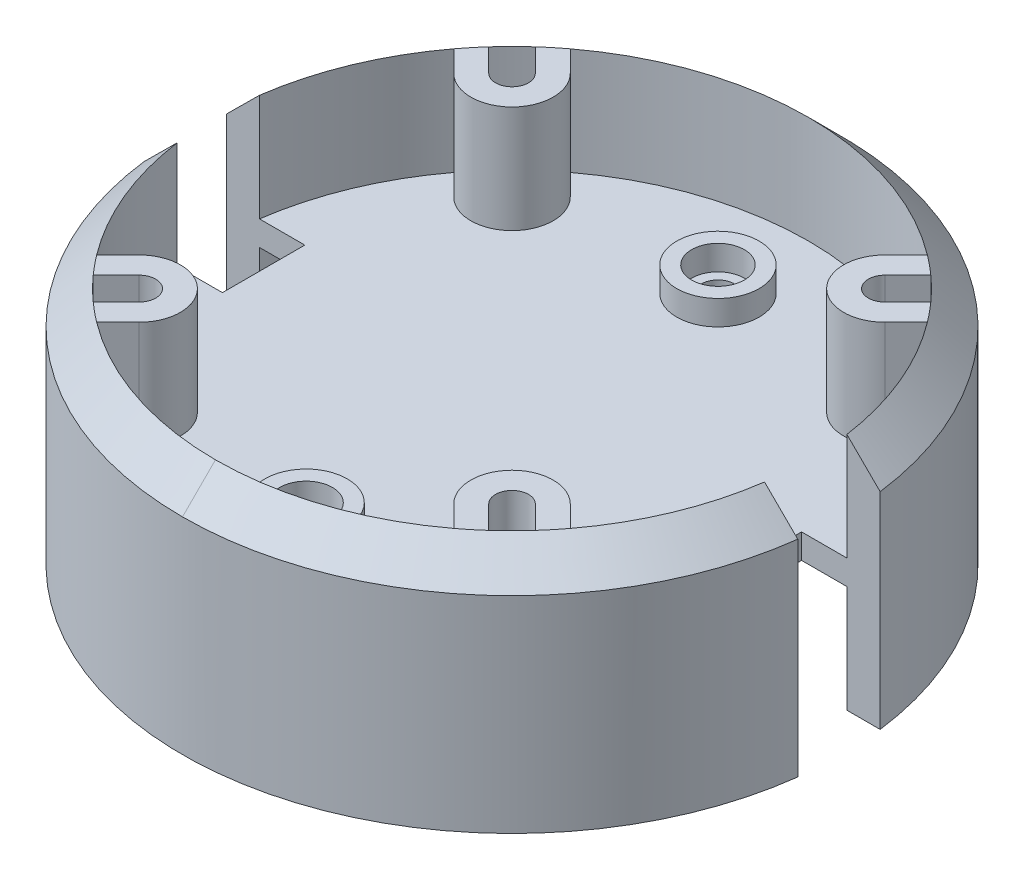
from build123d import *
from build123d.topology import SkipClean

# Parameters (mm, degrees)
SKETCH_1_R               = 18
EXTRUDE_1_DEPTH          = 1.5
EXTRUDE_2_DEPTH          = 6
EXTRUDE_2_DEPTH_BACK     = 6.5
SKETCH_2_R               = 20
SKETCH_2_R_2             = 18
CUT_EXTRUDE_START        = 1.5
SKETCH_6_R               = 1
CUT_EXTRUDE_4_DEPTH      = 8
CUT_EXTRUDE_5_DEPTH      = 30.393876913
CUT_EXTRUDE_5_DEPTH_BACK = 30.393876913
CUT_EXTRUDE_6_DEPTH      = 1.5
EXTRUDE_START            = 8
EXTRUDE_3_DEPTH          = 6.5
EXTRUDE_START_2          = 1.5
SKETCH_10_R              = 2.5
SKETCH_10_R_2            = 1.6
EXTRUDE_4_DEPTH          = 1.5


with BuildPart() as part:
    # 草图1 → 凸台-拉伸1 (new body)
    with BuildSketch(Plane(origin=(0, 0, 0), x_dir=(1, 0, 0), z_dir=(0, 1, 0))):
        with Locations(Location((0, 0, 0), (0, 0, 270))):
            Circle(SKETCH_1_R)
    extrude(amount=EXTRUDE_1_DEPTH)

    # 草图2 → 凸台-拉伸2 (add, two sides: drawn at the far end of the back side and taken through both)
    with BuildSketch(Plane(origin=(0, 0, 0), x_dir=(1, 0, 0), z_dir=(0, 1, 0)).offset(-EXTRUDE_2_DEPTH_BACK)):
        with Locations(Location((0, 0, 0), (0, 0, 270))):
            Circle(SKETCH_2_R)
        with Locations(Location((0, 0, 0), (0, 0, 270))):
            Circle(SKETCH_2_R_2, mode=Mode.SUBTRACT)
    extrude(amount=EXTRUDE_2_DEPTH + EXTRUDE_2_DEPTH_BACK)

    # 扫描2: sweep along a curve in space
    with SkipClean():  # the faces are left unmerged after this step: merging them gives an invalid solid
        with BuildLine() as sweep_2_path:
            ThreePointArc((0, 6, 18), (12.727922061, 6, 12.727922061), (18, 6, 0))
            ThreePointArc((18, 6, 0), (12.727922061, 6, -12.727922061), (0, 6, -18))
            ThreePointArc((0, 6, -18), (-12.727922061, 6, -12.727922061), (-18, 6, 0))
            ThreePointArc((-18, 6, 0), (-12.727922061, 6, 12.727922061), (0, 6, 18))
        # 草图5 → 扫描2 (sweep)
        with BuildSketch(Plane.XY):
            Polygon((-20, 6), (-18, 6), (-18, 8), align=None)
        sweep(path=sweep_2_path.line)

    # 草图6 → 切除-拉伸4 (cut)
    with SkipClean():  # the faces are left unmerged after this step: merging them gives an invalid solid
        with BuildSketch(Plane(origin=(0, 0, 0), x_dir=(1, 0, 0), z_dir=(0, 1, 0)).offset(CUT_EXTRUDE_START)):
            with Locations(Location((0, -12.5, 0), (0, 0, 270))):
                Circle(SKETCH_6_R)
            with Locations(Location((0, 12.5, 0), (0, 0, 270))):
                Circle(SKETCH_6_R)
        extrude(amount=-CUT_EXTRUDE_4_DEPTH, mode=Mode.SUBTRACT)

    # 草图7 → 切除-拉伸5 (cut, two sides: drawn at the far end of the back side and taken through both)
    with BuildSketch(Plane(origin=(0, 0, 0), x_dir=(1, 0, 0), z_dir=(0, 1, 0)).offset(-CUT_EXTRUDE_5_DEPTH_BACK)):
        with BuildLine():
            Line((-19.843134833, -2.5), (-15.07554347, -2.5))
            Line((-15.07554347, -2.5), (-15.07554347, 2.5))
            Line((-15.07554347, 2.5), (-19.843134833, 2.5))
            ThreePointArc((-19.843134833, 2.5), (-20, 0), (-19.843134833, -2.5))
        make_face()
        with BuildLine():
            Line((15.07554347, 2.5), (15.07554347, -2.5))
            Line((15.07554347, -2.5), (19.843134833, -2.5))
            ThreePointArc((19.843134833, -2.5), (20, 0), (19.843134833, 2.5))
            Line((19.843134833, 2.5), (15.07554347, 2.5))
        make_face()
    extrude(amount=CUT_EXTRUDE_5_DEPTH + CUT_EXTRUDE_5_DEPTH_BACK, mode=Mode.SUBTRACT)

    # 草图8 → 切除-拉伸6 (cut)
    with SkipClean():  # the faces are left unmerged after this step: merging them gives an invalid solid
        with BuildSketch(Plane(origin=(0, 0, 0), x_dir=(1, 0, 0), z_dir=(0, 1, 0)).offset(CUT_EXTRUDE_START)):
            with BuildLine():
                Line((10.606601706, 12.020815293), (12.001158233, 13.41537182))
                ThreePointArc((12.001158233, 13.41537182), (12.727922049, 12.727922074), (13.415371797, 12.001158259))
                Line((13.415371797, 12.001158259), (12.020815268, 10.606601731))
                ThreePointArc((12.020815268, 10.606601731), (10.606601706, 10.606601706), (10.606601706, 12.020815293))
            make_face()
            with BuildLine():
                Line((12.020815268, -10.606601731), (13.415371797, -12.001158259))
                ThreePointArc((13.415371797, -12.001158259), (12.727922049, -12.727922074), (12.001158233, -13.41537182))
                Line((12.001158233, -13.41537182), (10.606601706, -12.020815293))
                ThreePointArc((10.606601706, -12.020815293), (10.606601706, -10.606601706), (12.020815268, -10.606601731))
            make_face()
            with BuildLine():
                Line((-10.606601706, -12.020815293), (-12.001158233, -13.41537182))
                ThreePointArc((-12.001158233, -13.41537182), (-12.727922049, -12.727922074), (-13.415371797, -12.001158259))
                Line((-13.415371797, -12.001158259), (-12.020815268, -10.606601731))
                ThreePointArc((-12.020815268, -10.606601731), (-10.606601706, -10.606601706), (-10.606601706, -12.020815293))
            make_face()
            with BuildLine():
                Line((-12.020815268, 10.606601731), (-13.415371797, 12.001158259))
                ThreePointArc((-13.415371797, 12.001158259), (-12.727922049, 12.727922074), (-12.001158233, 13.41537182))
                Line((-12.001158233, 13.41537182), (-10.606601706, 12.020815293))
                ThreePointArc((-10.606601706, 12.020815293), (-10.606601706, 10.606601706), (-12.020815268, 10.606601731))
            make_face()
        extrude(amount=-CUT_EXTRUDE_6_DEPTH, mode=Mode.SUBTRACT)

    # 草图9 → 凸台-拉伸3 (add)
    with SkipClean():  # the faces are left unmerged after this step: merging them gives an invalid solid
        with BuildSketch(Plane(origin=(0, 0, 0), x_dir=(1, 0, 0), z_dir=(0, 1, 0)).offset(EXTRUDE_START)):
            with BuildLine():
                Line((12.020815268, -10.606601731), (13.415371797, -12.001158259))
                ThreePointArc((13.415371797, -12.001158259), (13.906042657, -11.428997228), (14.372329608, -10.836795727))
                Line((14.372329608, -10.836795727), (13.081475446, -9.545941553))
                ThreePointArc((13.081475446, -9.545941553), (9.545941558, -9.545941548), (9.545941537, -13.081475443))
                Line((9.545941537, -13.081475443), (10.8367957, -14.372329629))
                ThreePointArc((10.8367957, -14.372329629), (11.428997201, -13.906042679), (12.001158233, -13.41537182))
                Line((12.001158233, -13.41537182), (10.606601718, -12.020815281))
                ThreePointArc((10.606601718, -12.020815281), (10.606601731, -10.606601731), (12.020815268, -10.606601731))
            make_face()
            with BuildLine():
                Line((-10.606601718, -12.020815281), (-12.001158233, -13.41537182))
                ThreePointArc((-12.001158233, -13.41537182), (-11.428997201, -13.906042679), (-10.8367957, -14.372329629))
                Line((-10.8367957, -14.372329629), (-9.545941547, -13.081475453))
                ThreePointArc((-9.545941547, -13.081475453), (-9.545941551, -9.545941542), (-13.081475462, -9.545941556))
                Line((-13.081475462, -9.545941556), (-14.372329609, -10.836795726))
                ThreePointArc((-14.372329609, -10.836795726), (-13.906042657, -11.428997227), (-13.415371797, -12.001158259))
                Line((-13.415371797, -12.001158259), (-12.020815281, -10.606601718))
                ThreePointArc((-12.020815281, -10.606601718), (-10.606601718, -10.606601718), (-10.606601718, -12.020815281))
            make_face()
            with BuildLine():
                Line((10.606601718, 12.020815281), (12.001158233, 13.41537182))
                ThreePointArc((12.001158233, 13.41537182), (11.428997201, 13.906042679), (10.8367957, 14.372329629))
                Line((10.8367957, 14.372329629), (9.545941547, 13.081475453))
                ThreePointArc((9.545941547, 13.081475453), (9.545941551, 9.545941542), (13.081475462, 9.545941556))
                Line((13.081475462, 9.545941556), (14.372329609, 10.836795726))
                ThreePointArc((14.372329609, 10.836795726), (13.906042657, 11.428997227), (13.415371797, 12.001158259))
                Line((13.415371797, 12.001158259), (12.020815281, 10.606601718))
                ThreePointArc((12.020815281, 10.606601718), (10.606601718, 10.606601718), (10.606601718, 12.020815281))
            make_face()
            with BuildLine():
                Line((-12.020815268, 10.606601731), (-13.415371797, 12.001158259))
                ThreePointArc((-13.415371797, 12.001158259), (-13.906042657, 11.428997228), (-14.372329608, 10.836795727))
                Line((-14.372329608, 10.836795727), (-13.081475446, 9.545941553))
                ThreePointArc((-13.081475446, 9.545941553), (-9.545941558, 9.545941548), (-9.545941537, 13.081475443))
                Line((-9.545941537, 13.081475443), (-10.8367957, 14.372329629))
                ThreePointArc((-10.8367957, 14.372329629), (-11.428997201, 13.906042679), (-12.001158233, 13.41537182))
                Line((-12.001158233, 13.41537182), (-10.606601718, 12.020815281))
                ThreePointArc((-10.606601718, 12.020815281), (-10.606601731, 10.606601731), (-12.020815268, 10.606601731))
            make_face()
        extrude(amount=-EXTRUDE_3_DEPTH)

    # 草图10 → 凸台-拉伸4 (add)
    # profile 1 of 2: a face of its own
    with SkipClean():  # the faces are left unmerged after this step: merging them gives an invalid solid
        with BuildSketch(Plane(origin=(0, 0, 0), x_dir=(1, 0, 0), z_dir=(0, 1, 0)).offset(EXTRUDE_START_2)):
            with Locations(Location((0, 12.5, 0), (0, 0, 270))):
                Circle(SKETCH_10_R)
            with Locations(Location((0, 12.5, 0), (0, 0, 270))):
                Circle(SKETCH_10_R_2, mode=Mode.SUBTRACT)
        # profile 2 of 2: a face of its own
        with BuildSketch(Plane(origin=(0, 0, 0), x_dir=(1, 0, 0), z_dir=(0, 1, 0)).offset(EXTRUDE_START_2)):
            with Locations(Location((0, -12.5, 0), (0, 0, 270))):
                Circle(SKETCH_10_R)
            with Locations(Location((0, -12.5, 0), (0, 0, 270))):
                Circle(SKETCH_10_R_2, mode=Mode.SUBTRACT)
        extrude(amount=EXTRUDE_4_DEPTH)


solid = part.part
